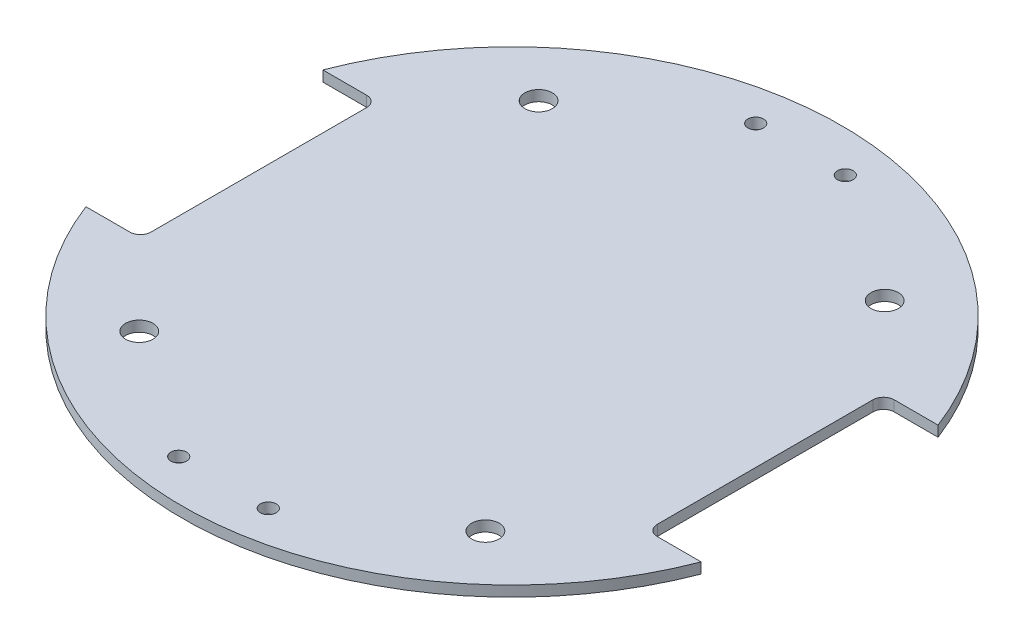
from build123d import *

# Parameters (mm, degrees)
SKETCH1_R               = 49.53
EXTRUDE1_DEPTH          = 1.5875
SKETCH2_R               = 2.06375
EXTRUDE2_DEPTH          = 10
MIRROR3_COPY_1_SKETCH_R = 2.06375
MIRROR3_COPY_1_DEPTH    = 10
MIRROR3_COPY_2_SKETCH_R = 2.06375
MIRROR3_COPY_2_DEPTH    = 10
CUT_EXTRUDE1_DEPTH      = 71.06398473
FILLET5_R               = 1.6
FILLET5_OF_MIRROR4_R    = 1.6
SKETCH4_R               = 1.18
CUT_EXTRUDE2_DEPTH      = 68.765197235
MIRROR6_COPY_1_SKETCH_R = 1.18
MIRROR6_COPY_1_DEPTH    = 68.765197235
MIRROR6_COPY_2_SKETCH_R = 1.18
MIRROR6_COPY_2_DEPTH    = 68.765197235


with BuildPart() as part:
    # Sketch1 → Extrude1 (new body)
    with BuildSketch(Plane(origin=(0, 0, 0), x_dir=(1, 0, 0), z_dir=(0, 1, 0))):
        Circle(SKETCH1_R)
    extrude(amount=EXTRUDE1_DEPTH)

    # Sketch2 → Extrude2 (cut)
    with BuildSketch(Plane(origin=(0, 1.5875, 0), x_dir=(-1, 0, 0), z_dir=(0, 1, 0))):
        with Locations((-26, -30)):
            Circle(SKETCH2_R)
    extrude2 = extrude(amount=-EXTRUDE2_DEPTH, mode=Mode.SUBTRACT)

    # Mirror1: Extrude2 across plane
    add(extrude2.mirror(Plane(origin=(0, 0, 0), x_dir=(0, 0, 1), z_dir=(1, 0, 0))), mode=Mode.SUBTRACT)

    # Mirror3 copy 1 sketch → Mirror3 copy 1 (cut)
    with BuildSketch(Plane(origin=(0, 1.5875, 0), x_dir=(1, 0, 0), z_dir=(0, 1, 0))):
        with Locations((-26, -30)):
            Circle(MIRROR3_COPY_1_SKETCH_R)
    extrude(amount=-MIRROR3_COPY_1_DEPTH, mode=Mode.SUBTRACT)

    # Mirror3 copy 2 sketch → Mirror3 copy 2 (cut)
    with BuildSketch(Plane(origin=(0, 1.5875, 0), x_dir=(-1, 0, 0), z_dir=(0, 1, 0))):
        with Locations((-26, 30)):
            Circle(MIRROR3_COPY_2_SKETCH_R)
    extrude(amount=-MIRROR3_COPY_2_DEPTH, mode=Mode.SUBTRACT)

    # Sketch3 → Cut-Extrude1 (cut, through all)
    with BuildSketch(Plane(origin=(0, 1.5875, 0), x_dir=(1, 0, 0), z_dir=(0, 1, 0))):
        with BuildLine():
            Line((38.03, 0), (38.03, 17.8))
            Line((38.03, 17.8), (46.221000638, 17.8))
            ThreePointArc((46.221000638, 17.8), (49.53, 0), (46.221000638, -17.8))
            Line((46.221000638, -17.8), (38.03, -17.8))
            Line((38.03, -17.8), (38.03, 0))
        make_face()
    cut_extrude1 = extrude(amount=-CUT_EXTRUDE1_DEPTH, mode=Mode.SUBTRACT)

    # Fillet5
    fillet5_edges = [part.edges().sort_by_distance(p)[0] for p in [
        (38.03, 0.79375, 17.8),
        (38.03, 0.79375, -17.8),
    ]]
    fillet(fillet5_edges, radius=FILLET5_R)

    # Mirror4: Cut-Extrude1 across plane
    add(cut_extrude1.mirror(Plane(origin=(0, 0, 0), x_dir=(0, 0, 1), z_dir=(1, 0, 0))), mode=Mode.SUBTRACT)

    # Fillet5 of Mirror4
    fillet5_of_mirror4_edges = [part.edges().sort_by_distance(p)[0] for p in [
        (-38.03, 0.79375, 17.8),
        (-38.03, 0.79375, -17.8),
    ]]
    fillet(fillet5_of_mirror4_edges, radius=FILLET5_OF_MIRROR4_R)

    # Sketch4 → Cut-Extrude2 (cut, through all)
    with BuildSketch(Plane(origin=(0, 1.5875, 0), x_dir=(1, 0, 0), z_dir=(0, 1, 0))):
        with Locations((6.731, -43.35)):
            Circle(SKETCH4_R)
    cut_extrude2 = extrude(amount=-CUT_EXTRUDE2_DEPTH, mode=Mode.SUBTRACT)

    # Mirror5: Cut-Extrude2 across plane
    add(cut_extrude2.mirror(Plane.XY), mode=Mode.SUBTRACT)

    # Mirror6 copy 1 sketch → Mirror6 copy 1 (cut, through all)
    with BuildSketch(Plane(origin=(0, 1.5875, 0), x_dir=(-1, 0, 0), z_dir=(0, 1, 0))):
        with Locations((6.731, -43.35)):
            Circle(MIRROR6_COPY_1_SKETCH_R)
    extrude(amount=-MIRROR6_COPY_1_DEPTH, mode=Mode.SUBTRACT)

    # Mirror6 copy 2 sketch → Mirror6 copy 2 (cut, through all)
    with BuildSketch(Plane(origin=(0, 1.5875, 0), x_dir=(-1, 0, 0), z_dir=(0, 1, 0))):
        with Locations((6.731, 43.35)):
            Circle(MIRROR6_COPY_2_SKETCH_R)
    extrude(amount=-MIRROR6_COPY_2_DEPTH, mode=Mode.SUBTRACT)


solid = part.part
